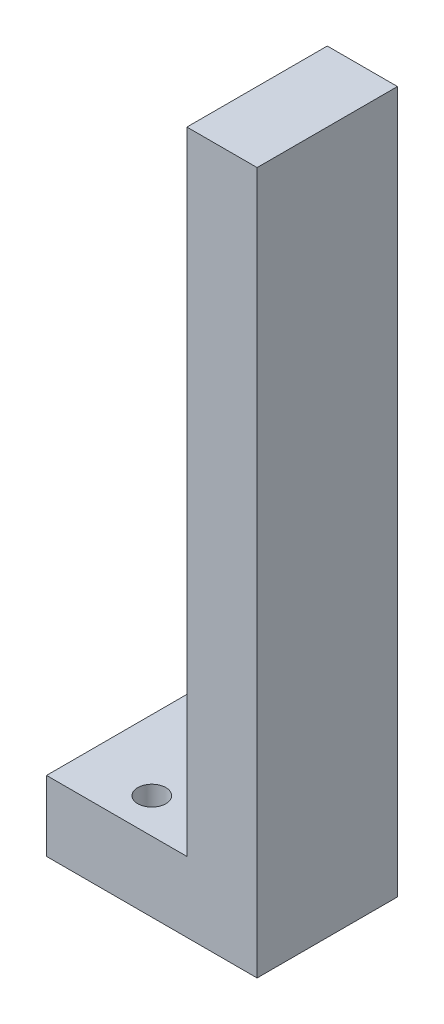
from build123d import *

# Parameters (mm, degrees)
SKETCH1_W           = 5
SKETCH1_H           = 50
BOSS_EXTRUDE1_DEPTH = 5
SKETCH2_W           = 10
SKETCH2_H           = 5
BOSS_EXTRUDE2_DEPTH = 10
SKETCH3_R           = 1
CUT_EXTRUDE1_DEPTH  = 47.97073557


with BuildPart() as part:
    # Sketch1 → Boss-Extrude1 (new, symmetric)
    with BuildSketch(Plane.XY):
        Rectangle(SKETCH1_W, SKETCH1_H)
    extrude(amount=BOSS_EXTRUDE1_DEPTH, both=True)

    # Sketch2 → Boss-Extrude2 (add)
    with BuildSketch(Plane.ZY.offset(2.5)):
        with Locations((0, -22.5)):
            Rectangle(SKETCH2_W, SKETCH2_H)
    extrude(amount=BOSS_EXTRUDE2_DEPTH)

    # Sketch3 → Cut-Extrude1 (cut, through all)
    with BuildSketch(Plane(origin=(0, -20, 0), x_dir=(1, 0, 0), z_dir=(0, 1, 0))):
        with Locations(Location((-7.5, 2.5, 0), (0, 0, 270))):
            Circle(SKETCH3_R)
        with Locations(Location((-7.5, -2.5, 0), (0, 0, 270))):
            Circle(SKETCH3_R)
    extrude(amount=-CUT_EXTRUDE1_DEPTH, mode=Mode.SUBTRACT)


solid = part.part
